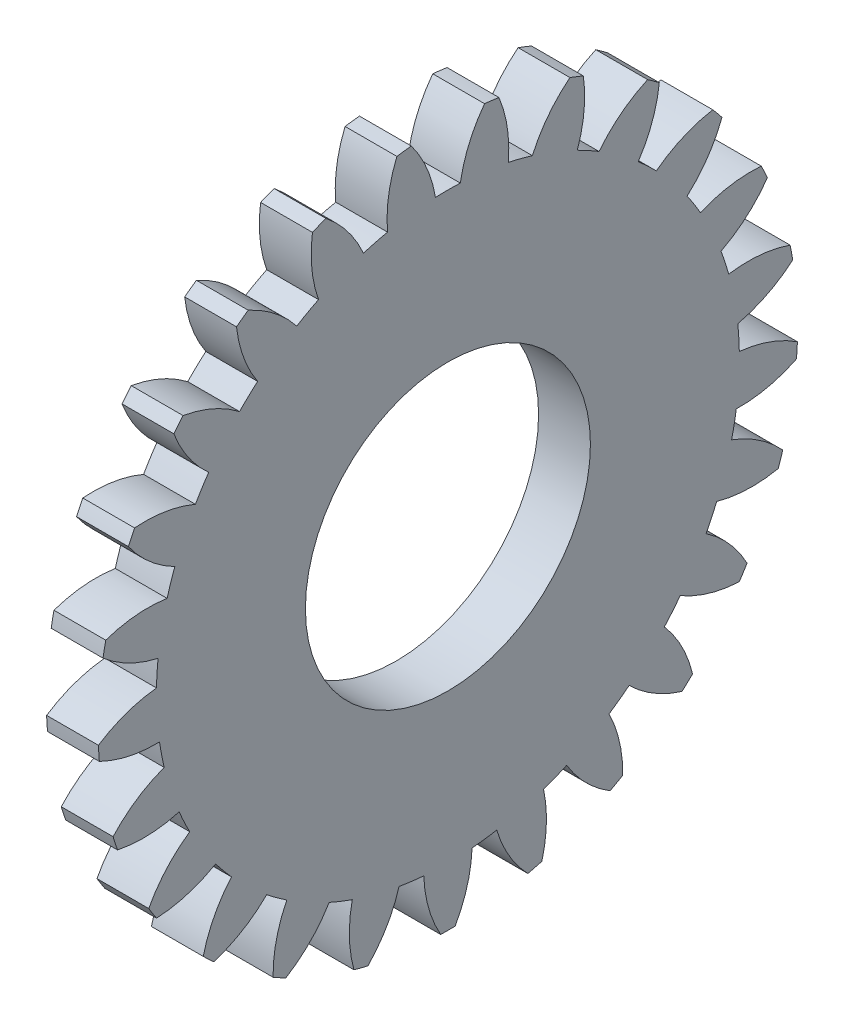
from build123d import *

# Parameters (mm, degrees)
BASPROSKE_W     = 2
BASPROSKE_H     = 13.5
TOOTHCUT_DEPTH  = 20.19635382
TEETHCUTS_COUNT = 25
TEETHCUTS_ANGLE = 345.6
BORSKE_R        = 5.5
BORE_DEPTH      = 50.0000508


with BuildPart() as part:
    # BasProSke → Base-Revolve (revolve)
    with BuildSketch(Plane(origin=(0, 0, 0), x_dir=(1, 0, 0), z_dir=(0, 1, 0)), mode=Mode.PRIVATE) as base_revolve_sk:
        with Locations((1, 6.75)):
            Rectangle(BASPROSKE_W, BASPROSKE_H)
    revolve(base_revolve_sk.sketch.rotate(Axis((-10, 0, 0), (1, 0, 0)), 180), axis=Axis((-10, 0, 0), (1, 0, 0)))

    # TooCutSke → ToothCut (cut, through all)
    with BuildSketch(Plane(origin=(0, 0, 0), x_dir=(0, 0, -1), z_dir=(1, 0, 0))):
        with BuildLine():
            ThreePointArc((0.480087995, 11.238750665), (0, 11.249), (-0.480087995, 11.238750665))
            ThreePointArc((-0.480087995, 11.238750665), (-0.821124963, 12.40220054), (-1.432168974, 13.449361962))
            ThreePointArc((-1.432168974, 13.449361962), (0, 13.5254), (1.432168974, 13.449361962))
            ThreePointArc((1.432168974, 13.449361962), (0.821124963, 12.40220054), (0.480087995, 11.238750665))
        make_face()
    toothcut = extrude(amount=TOOTHCUT_DEPTH, mode=Mode.SUBTRACT)

    # TeethCuts: ToothCut ×25 about axis
    teethcuts_axis = Axis((-10, 0, 0), (1, 0, 0))
    for i in range(1, TEETHCUTS_COUNT):
        add(toothcut.rotate(teethcuts_axis, i * TEETHCUTS_ANGLE / (TEETHCUTS_COUNT - 1)), mode=Mode.SUBTRACT)

    # BorSke → Bore (cut, symmetric)
    with BuildSketch(Plane(origin=(0, 0, 0), x_dir=(0, 0, -1), z_dir=(1, 0, 0))):
        with Locations(Location((0, 0, 0), (0, 0, 180))):
            Circle(BORSKE_R)
    extrude(amount=BORE_DEPTH, both=True, mode=Mode.SUBTRACT)


solid = part.part
